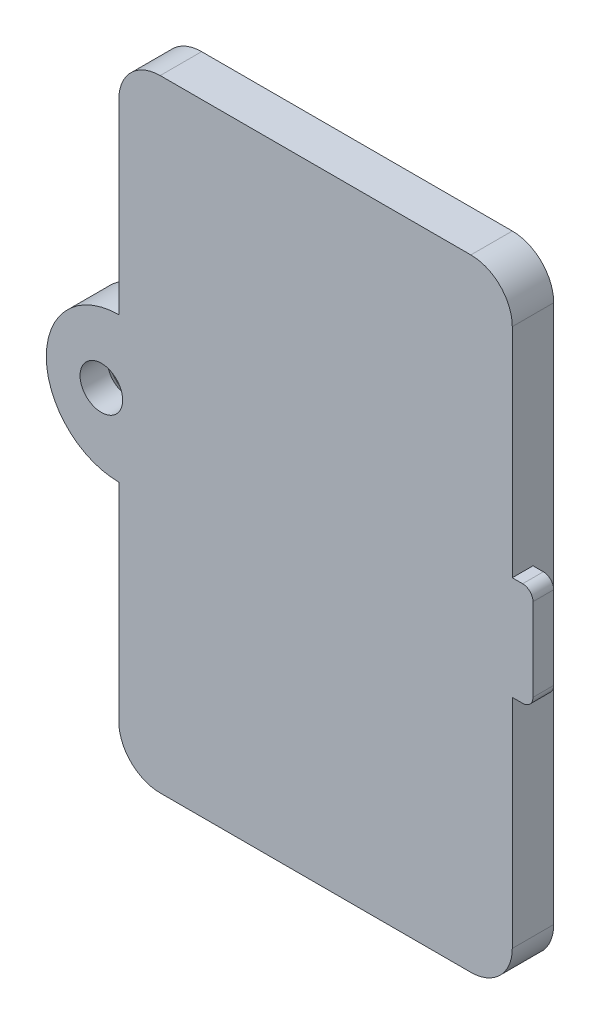
from build123d import *

# Parameters (mm, degrees)
BOSS_EXTRUDE1_DEPTH                               = 1
BOSS_EXTRUDE1_DEPTH_BACK                          = 1
SKETCH2_W                                         = 1
SKETCH2_H                                         = 5
BOSS_EXTRUDE3_DEPTH                               = 1
FILLET1_R                                         = 2
FILLET2_R                                         = 0.5
CSK_FOR_1_FLAT_HEAD_MACHINE_SCREW_100_D           = 2.0574
CSK_FOR_1_FLAT_HEAD_MACHINE_SCREW_100_DEPTH       = 5.381894681
CSK_FOR_1_FLAT_HEAD_MACHINE_SCREW_100_CSINK_D     = 3.7084
CSK_FOR_1_FLAT_HEAD_MACHINE_SCREW_100_CSINK_ANGLE = 100
CSK_FOR_1_FLAT_HEAD_MACHINE_SCREW_100_TIP         = 0.618105319


with BuildPart() as part:
    # Sketch1 → Boss-Extrude1 (new, two sides: drawn at the far end of the back side and taken through both)
    with BuildSketch(Plane.XY.offset(-BOSS_EXTRUDE1_DEPTH_BACK)):
        with BuildLine():
            Line((-70.765177629, -17.59), (-51.765177629, -17.59))
            Line((-51.765177629, -17.59), (-51.765177629, -47.59))
            Line((-51.765177629, -47.59), (-70.765177629, -47.59))
            Line((-70.765177629, -47.59), (-70.765177629, -35.59))
            ThreePointArc((-70.765177629, -35.59), (-74.265177629, -32.09), (-70.765177629, -28.59))
            Line((-70.765177629, -28.59), (-70.765177629, -17.59))
        make_face()
    extrude(amount=BOSS_EXTRUDE1_DEPTH + BOSS_EXTRUDE1_DEPTH_BACK)

    # Sketch2 → Boss-Extrude3 (add)
    with BuildSketch(Plane.XY.offset(1)):
        with Locations((-51.265177629, -32.59)):
            Rectangle(SKETCH2_W, SKETCH2_H)
    extrude(amount=-BOSS_EXTRUDE3_DEPTH)

    # Fillet1
    fillet1_edges = [part.edges().sort_by_distance(p)[0] for p in [
        (-70.765177629, -17.59, 0),
        (-51.765177629, -17.59, 0),
        (-51.765177629, -47.59, 0),
        (-70.765177629, -47.59, 0),
    ]]
    fillet(fillet1_edges, radius=FILLET1_R)

    # Fillet2
    fillet2_edges = [part.edges().sort_by_distance(p)[0] for p in [
        (-50.765177629, -30.09, 0.5),
        (-50.765177629, -35.09, 0.5),
    ]]
    fillet(fillet2_edges, radius=FILLET2_R)

    # CSK for #1 Flat Head Machine Screw (100)1
    with Locations(Plane(origin=(-71.606429364, -32.068746038, -1), x_dir=(-1, 0, 0), z_dir=(0, 0, -1))):
        with Locations((0, 0)):
            CounterSinkHole(CSK_FOR_1_FLAT_HEAD_MACHINE_SCREW_100_D / 2, CSK_FOR_1_FLAT_HEAD_MACHINE_SCREW_100_CSINK_D / 2, depth=CSK_FOR_1_FLAT_HEAD_MACHINE_SCREW_100_DEPTH, counter_sink_angle=CSK_FOR_1_FLAT_HEAD_MACHINE_SCREW_100_CSINK_ANGLE)
            with Locations((0, 0, -(CSK_FOR_1_FLAT_HEAD_MACHINE_SCREW_100_DEPTH + CSK_FOR_1_FLAT_HEAD_MACHINE_SCREW_100_TIP / 2))):  # 118° drill point
                Cone(0, CSK_FOR_1_FLAT_HEAD_MACHINE_SCREW_100_D / 2, CSK_FOR_1_FLAT_HEAD_MACHINE_SCREW_100_TIP, mode=Mode.SUBTRACT)


solid = part.part
